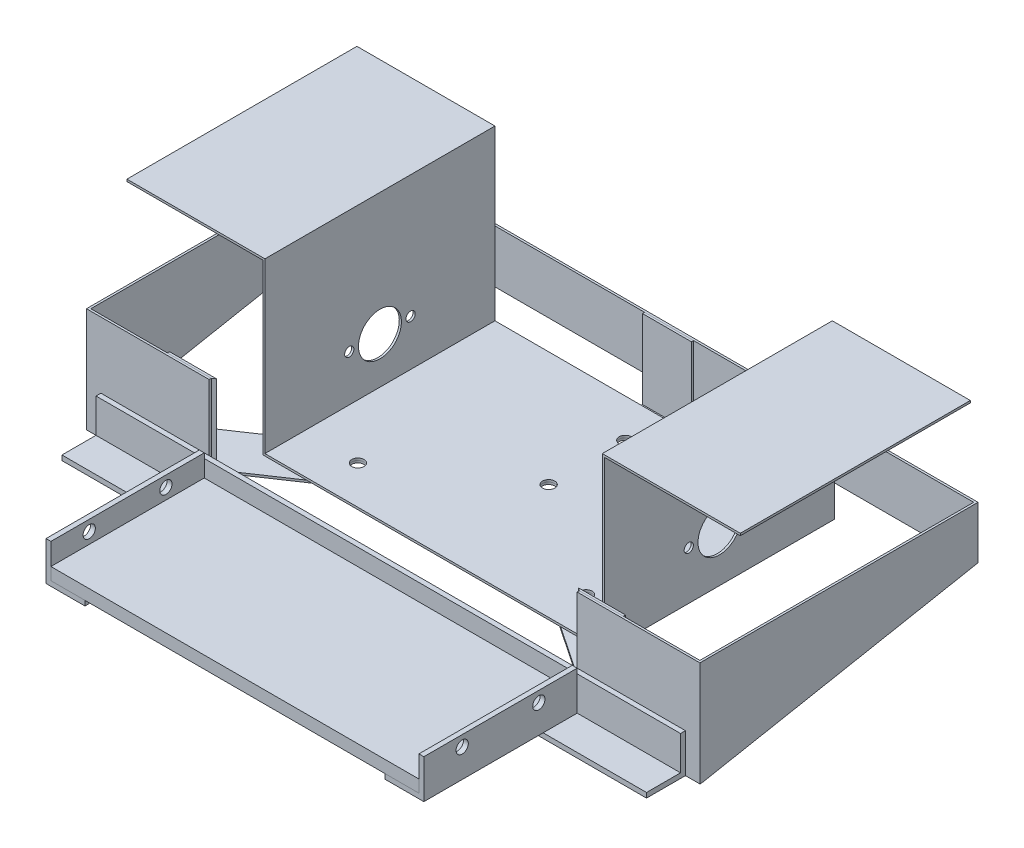
from build123d import *

# Parameters (mm, degrees)
PLATFORM_START                 = 18
SKETCH2_W                      = 120
SKETCH2_H                      = 50
PLATFORM_DEPTH                 = 4
ALU_ANGLE_PLATFORM_REST_DEPTH  = 95.3
PLATFORM_ANGLE_RH_DEPTH        = 50
CUT_EXTRUDE2_START             = -61.6
SKETCH19_R                     = 2
CUT_EXTRUDE2_DEPTH             = 1.6
OUTER_START                    = 10.8
OUTER_FRAME_DEPTH              = 34.2
CUT_EXTRUDE_THIN1_REACH        = 151.957
EXTRUDE_THIN3_DEPTH            = 37.5
CUT_EXTRUDE3_DEPTH             = 162.514725016
CUT_EXTRUDE3_DEPTH_BACK        = 162.514725016
DRIVE_AXLE_HOLES_R             = 7
DRIVE_AXLE_HOLES_R_2           = 5
SKETCH26_W                     = 1.5
SKETCH26_H                     = 155.7
F_3_0MM_DOWEL_HOLE1_AT_2_COUNT = 2
F_3_0MM_DOWEL_HOLE1_AT_2_PITCH = 20
SKETCH27_W                     = 16
SKETCH27_H                     = 0.7
SKETCH27_H_2                   = 1.1
BOSS_EXTRUDE1_DEPTH            = 0.7
SKETCH27_3_W                   = 16
SKETCH27_3_H                   = 0.7
BOSS_EXTRUDE2_DEPTH            = 25.7
BOSS_EXTRUDE2_2_DEPTH          = 25.7
BOSS_EXTRUDE2_3_DEPTH          = 25.7
CUT_EXTRUDE4_DEPTH             = 154.254710848
CUT_EXTRUDE4_DEPTH_BACK        = 154.254710848
SKETCH28_R                     = 2


with BuildPart() as part:
    # Sketch2 → Platform (new body)
    with BuildSketch(Plane(origin=(0, 0, 0), x_dir=(1, 0, 0), z_dir=(0, 1, 0)).offset(PLATFORM_START)):
        with Locations((0, -77.28394985)):
            Rectangle(SKETCH2_W, SKETCH2_H)
    extrude(amount=-PLATFORM_DEPTH)


with BuildPart() as body_2:
    # Sketch3 → Alu Angle Platform Rest (new, symmetric)
    with BuildSketch(Plane(origin=(0, 0, 0), x_dir=(0, 0, -1), z_dir=(1, 0, 0))):
        Polygon((-52.28394985, 23.5), (-52.28394985, 12.4), (-63.38394985, 12.4), (-63.38394985, 10.8), (-50.68394985, 10.8), (-50.68394985, 23.5), align=None)
    extrude(amount=ALU_ANGLE_PLATFORM_REST_DEPTH, both=True)


with BuildPart() as body_3:
    # Sketch8 → Platform Angle RH (new body)
    with BuildSketch(Plane.XY.offset(102.28394985)):
        Polygon((-48.9, 12.4), (-61.6, 12.4), (-61.6, 25.1), (-60, 25.1), (-60, 14), (-48.9, 14), align=None)
    extrude(amount=-PLATFORM_ANGLE_RH_DEPTH)

    # Sketch19 → Cut-Extrude2 (cut)
    with BuildSketch(Plane(origin=(0, 0, 0), x_dir=(0, 0, -1), z_dir=(1, 0, 0)).offset(CUT_EXTRUDE2_START)):
        with Locations((-89.78394985, 21.6)):
            Circle(SKETCH19_R)
        with Locations((-64.78394985, 21.6)):
            Circle(SKETCH19_R)
    extrude(amount=CUT_EXTRUDE2_DEPTH, mode=Mode.SUBTRACT)


with BuildPart() as body_4:
    # Platform Angle LH: mirrored copy
    add(body_3.part.mirror(Plane(origin=(0, 0, 0), x_dir=(0, 0, 1), z_dir=(1, 0, 0))))


with BuildPart() as body_5:
    # Sketch20 → Outer Frame (new body)
    with BuildSketch(Plane(origin=(0, 0, 0), x_dir=(1, 0, 0), z_dir=(0, 1, 0)).offset(OUTER_START)):
        Polygon((-60, -50.68394985), (-100, -50.68394985), (-100, 40), (0, 40), (0, 39.3), (-99.3, 39.3), (-99.3, -49.98394985), (-60, -49.98394985), align=None)
    extrude(amount=OUTER_FRAME_DEPTH)

    # Cut-Extrude-Thin1: up to this face of the body (flat: up to its plane)
    cut_extrude_thin1_end = Plane(body_5.part.faces().sort_by_distance((-100, 27.9, 5.341974925))[0])
    # Sketch22 → Cut-Extrude-Thin1 (cut, up to the picked face)
    with BuildSketch(Plane(origin=(0, 0, 0), x_dir=(0, 0, -1), z_dir=(1, 0, 0)), mode=Mode.PRIVATE) as cut_extrude_thin1_sk1:
        Polygon((40, 27.9), (-49.98394985, 10.8), (-49.853264905, 10.112307158), (40.130684946, 27.212307158), align=None)
    cut_extrude_thin1_tool1 = split(extrude(cut_extrude_thin1_sk1.sketch, amount=-CUT_EXTRUDE_THIN1_REACH, mode=Mode.PRIVATE), bisect_by=cut_extrude_thin1_end, keep=Keep.BOTH, mode=Mode.PRIVATE)
    add(cut_extrude_thin1_tool1.solids().sort_by(Axis((0, 19.006154, 4.926632), (-1, 0, 0)))[0], mode=Mode.SUBTRACT)


with BuildPart() as body_6:
    # of the pieces the cut leaves, the one that is kept (cut_extrude_thin1_keep)
    add(body_5.part.solids().sort_by_distance((-60, 10.8, 50.68394985))[0])

    # Mirror1: body 6 across plane


with BuildPart() as body_6_1:
    add(body_6.part)
    add(body_6.part.mirror(Plane(origin=(0, 0, 0), x_dir=(0, 0, 1), z_dir=(1, 0, 0))))


with BuildPart() as body_6_2:
    # Sketch24 → Extrude-Thin3 (new, symmetric)
    with BuildSketch(Plane.XY):
        Polygon((-100, 75), (-55, 75), (-55, 20), (55, 20), (55, 75), (100, 75), (100, 74.3), (55.7, 74.3), (55.7, 19.3), (-55.7, 19.3), (-55.7, 74.3), (-100, 74.3), align=None)
    extrude(amount=EXTRUDE_THIN3_DEPTH, both=True)

    # Drive Axle Holes → Cut-Extrude3 (cut, two sides: drawn at the far end of the back side and taken through both)
    # profile 1 of 2: a face of its own
    with BuildSketch(Plane(origin=(0, 0, 0), x_dir=(0, 0, -1), z_dir=(1, 0, 0)).offset(-CUT_EXTRUDE3_DEPTH_BACK)):
        with Locations(Location((0, 35, 0), (0, 0, 90))):
            Circle(DRIVE_AXLE_HOLES_R)
        with Locations((0, 35)):
            Circle(DRIVE_AXLE_HOLES_R_2, mode=Mode.SUBTRACT)
    # profile 2 of 2: a face of its own
    with BuildSketch(Plane(origin=(0, 0, 0), x_dir=(0, 0, -1), z_dir=(1, 0, 0)).offset(-CUT_EXTRUDE3_DEPTH_BACK)):
        with Locations((0, 35)):
            Circle(DRIVE_AXLE_HOLES_R_2)
    extrude(amount=CUT_EXTRUDE3_DEPTH + CUT_EXTRUDE3_DEPTH_BACK, mode=Mode.SUBTRACT)

    # Sketch26 → Ø3.0mm Dowel Hole1 (revolve, cut)
    with BuildSketch(Plane(origin=(55.7, 35, 10), x_dir=(0, 0, -1), z_dir=(0, 1, 0))):
        with Locations((0.75, 77.85)):
            Rectangle(SKETCH26_W, SKETCH26_H)
    f_3_0mm_dowel_hole1 = revolve(axis=Axis((62.05, 35, 10), (-1, 0, 0)), mode=Mode.SUBTRACT)

    # Ø3.0mm Dowel Hole1 at 2: Ø3.0mm Dowel Hole1 ×2
    with Locations(*[(0, 0, -i * F_3_0MM_DOWEL_HOLE1_AT_2_PITCH) for i in range(1, F_3_0MM_DOWEL_HOLE1_AT_2_COUNT)]):
        add(f_3_0mm_dowel_hole1, mode=Mode.SUBTRACT)


with BuildPart() as body_7:
    # Sketch27 → Boss-Extrude1 (new body)
    with BuildSketch(Plane(origin=(0, 19.3, 0), x_dir=(-1, 0, 0), z_dir=(0, -1, 0))):
        with Locations((0, 38.95)):
            Rectangle(SKETCH27_W, SKETCH27_H)
        with Locations((0, 38.05)):
            Rectangle(SKETCH27_W, SKETCH27_H_2)
        Polygon((55.7, -37.5), (55.7, -27.812063669), (8, 4.261141559), (8, 37.5), (-8, 37.5), (-8, 4.261141559), (-55.7, -27.812063669), (-55.7, -37.5), (-41.43358596, -37.5), (0, -9.640295476), (41.43358596, -37.5), align=None)
        Polygon((74.337266604, -49.28394985), (74.337266604, -40.343654375), (55.7, -27.812063669), (55.7, -37.5), (41.43358596, -37.5), (58.958944085, -49.28394985), align=None)
        Polygon((74.337266604, -49.98394985), (74.337266604, -49.28394985), (58.958944085, -49.28394985), (60, -49.98394985), align=None)
        Polygon((-58.958944085, -49.28394985), (-41.43358596, -37.5), (-55.7, -37.5), (-55.7, -27.812063669), (-74.337266604, -40.343654375), (-74.337266604, -49.28394985), align=None)
        Polygon((-60, -49.98394985), (-58.958944085, -49.28394985), (-74.337266604, -49.28394985), (-74.337266604, -49.98394985), align=None)
    extrude(amount=BOSS_EXTRUDE1_DEPTH)


with BuildPart() as body_8:
    # Sketch27<3> → Boss-Extrude2 (new body)
    with BuildSketch(Plane(origin=(0, 19.3, 0), x_dir=(-1, 0, 0), z_dir=(0, -1, 0))):
        with Locations((0, 38.95)):
            Rectangle(SKETCH27_3_W, SKETCH27_3_H)
    extrude(amount=-BOSS_EXTRUDE2_DEPTH)


with BuildPart() as body_9:
    # Sketch27<3> → Boss-Extrude2 2 (new body)
    with BuildSketch(Plane(origin=(0, 19.3, 0), x_dir=(-1, 0, 0), z_dir=(0, -1, 0))):
        Polygon((-60, -49.98394985), (-58.958944085, -49.28394985), (-74.337266604, -49.28394985), (-74.337266604, -49.98394985), align=None)
    extrude(amount=-BOSS_EXTRUDE2_2_DEPTH)


with BuildPart() as body_10:
    # Sketch27<3> → Boss-Extrude2 3 (new body)
    with BuildSketch(Plane(origin=(0, 19.3, 0), x_dir=(-1, 0, 0), z_dir=(0, -1, 0))):
        Polygon((74.337266604, -49.98394985), (74.337266604, -49.28394985), (58.958944085, -49.28394985), (60, -49.98394985), align=None)
    extrude(amount=-BOSS_EXTRUDE2_3_DEPTH)


with BuildPart() as cut_extrude4_tool:
    # Sketch28 → Cut-Extrude4 (new, two sides: drawn at the far end of the back side and taken through both)
    with BuildSketch(Plane(origin=(0, 20, 0), x_dir=(1, 0, 0), z_dir=(0, 1, 0)).offset(-CUT_EXTRUDE4_DEPTH_BACK)):
        with Locations(Location((0, 0, 0), (0, 0, 90))):
            Circle(SKETCH28_R)
        with Locations(Location((0, 25, 0), (0, 0, 90))):
            Circle(SKETCH28_R)
        with Locations(Location((-37.180568376, -25, 0), (0, 0, 90))):
            Circle(SKETCH28_R)
        with Locations(Location((37.180568376, -25, 0), (0, 0, 90))):
            Circle(SKETCH28_R)
    extrude(amount=CUT_EXTRUDE4_DEPTH + CUT_EXTRUDE4_DEPTH_BACK)


with BuildPart() as body_6_2_1:
    add(body_6_2.part)

    # Cut-Extrude4: cut by cut_extrude4_tool
    add(cut_extrude4_tool.part, mode=Mode.SUBTRACT)


with BuildPart() as body_7_1:
    add(body_7.part)

    # Cut-Extrude4: cut by cut_extrude4_tool
    add(cut_extrude4_tool.part, mode=Mode.SUBTRACT)


solid = Compound([part.part, body_2.part, body_3.part, body_4.part, body_6_1.part, body_8.part, body_9.part, body_10.part, body_6_2_1.part, body_7_1.part])
